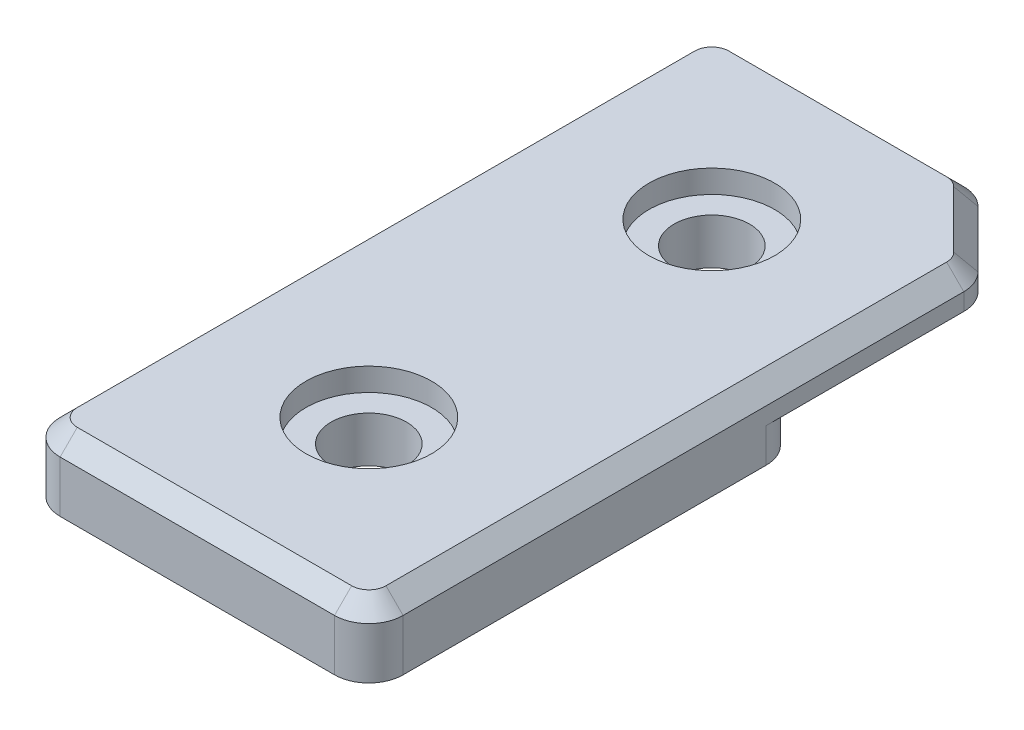
from build123d import *

# Parameters (mm, degrees)
SKETCH1_W                                           = 30
SKETCH1_H                                           = 60
BOSS_EXTRUDE1_DEPTH                                 = 6
CUT_EXTRUDE1_DEPTH                                  = 3
CUT_EXTRUDE2_DEPTH                                  = 34.674916481
FILLET1_R                                           = 3
CHAMFER1_SIZE                                       = 1.5
CBORE_FOR_M6_HEX_SOCKET_HEAD_CAP_SCREW1_D           = 6.6
CBORE_FOR_M6_HEX_SOCKET_HEAD_CAP_SCREW1_CBORE_D     = 11
CBORE_FOR_M6_HEX_SOCKET_HEAD_CAP_SCREW1_CBORE_DEPTH = 2


with BuildPart() as part:
    # Sketch1 → Boss-Extrude1 (new body)
    with BuildSketch(Plane(origin=(0, 0, 0), x_dir=(1, 0, 0), z_dir=(0, 1, 0))):
        Rectangle(SKETCH1_W, SKETCH1_H)
    extrude(amount=BOSS_EXTRUDE1_DEPTH)

    # Sketch2 → Cut-Extrude1 (cut)
    with BuildSketch(Plane.XZ):
        Polygon((15, -6), (-9, -30), (15, -30), align=None)
    extrude(amount=-CUT_EXTRUDE1_DEPTH, mode=Mode.SUBTRACT)

    # Sketch3 → Cut-Extrude2 (cut, through all)
    with BuildSketch(Plane.XZ.offset(-3)):
        Polygon((15, -23.282485579), (15, -30), (8.282485579, -30), align=None)
    extrude(amount=-CUT_EXTRUDE2_DEPTH, mode=Mode.SUBTRACT)

    # Fillet1
    fillet1_edges = [part.edges().sort_by_distance(p)[0] for p in [
        (15, 1.5, -6),
        (-9, 1.5, -30),
        (8.282485579, 4.5, -30),
        (15, 4.5, -23.282485579),
        (15, 3, 30),
        (-15, 3, 30),
        (-15, 3, -30),
    ]]
    fillet(fillet1_edges, radius=FILLET1_R)

    # Chamfer1
    chamfer1_edges = [part.edges().sort_by_distance(p)[0] for p in [
        (15, 6, 2.480077554),
        (-2.480077554, 6, -30),
        (0, 6, 30),
        (-15, 6, 0),
        (11.641242789, 6, -26.641242789),
        (14.121320344, 6, 29.121320344),
        (14.771638598, 6, -23.187895189),
        (8.187895189, 6, -29.771638598),
        (-14.121320344, 6, -29.121320344),
        (-14.121320344, 6, 29.121320344),
    ]]
    chamfer(chamfer1_edges, length=CHAMFER1_SIZE)

    # CBORE for M6 Hex Socket Head Cap Screw1 (through all)
    with Locations(Plane(origin=(0, 6, 0), x_dir=(1, 0, 0), z_dir=(0, 1, 0))):
        with Locations((0, -15), (0, 15)):
            CounterBoreHole(CBORE_FOR_M6_HEX_SOCKET_HEAD_CAP_SCREW1_D / 2, CBORE_FOR_M6_HEX_SOCKET_HEAD_CAP_SCREW1_CBORE_D / 2, CBORE_FOR_M6_HEX_SOCKET_HEAD_CAP_SCREW1_CBORE_DEPTH)


solid = part.part
